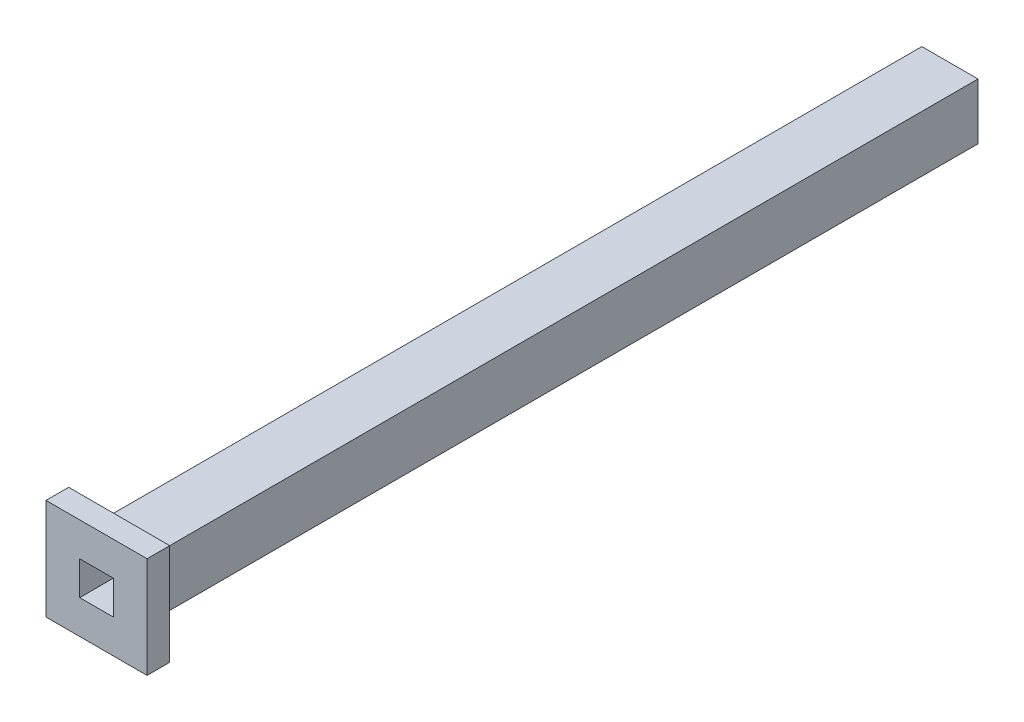
from build123d import *

# Parameters (mm, degrees)
SKETCH1_W            = 10
SKETCH1_H            = 10
SKETCH1_W_2          = 6
SKETCH1_H_2          = 6
BOSS_EXTRUDE1_DEPTH  = 2.54
BOSS_EXTRUDE4_DEPTH  = 2.54
CUT_EXTRUDE4_DEPTH   = 2.54
BOSS_EXTRUDE6_DEPTH  = 2.54
BOSS_EXTRUDE7_DEPTH  = 2.54
SKETCH8_W            = 16
SKETCH8_H            = 16
SKETCH8_W_2          = 12
SKETCH8_H_2          = 12
CUT_EXTRUDE5_DEPTH   = 0.5
SKETCH9_W            = 8
SKETCH9_H            = 8
BOSS_EXTRUDE8_DEPTH  = 0.5
SKETCH10_W           = 12
SKETCH10_H           = 12
SKETCH10_W_2         = 8
SKETCH10_H_2         = 8
CUT_EXTRUDE6_DEPTH   = 10
SKETCH11_W           = 16
SKETCH11_H           = 16
SKETCH11_W_2         = 8
SKETCH11_H_2         = 8
BOSS_EXTRUDE9_DEPTH  = 2
SKETCH13_W           = 8
SKETCH13_H           = 8
CUT_EXTRUDE7_DEPTH   = 2
SKETCH14_W           = 10
SKETCH14_H           = 10
SKETCH14_W_2         = 6
SKETCH14_H_2         = 6
CUT_EXTRUDE8_DEPTH   = 2
SKETCH16_W           = 14
SKETCH16_H           = 14
SKETCH16_W_2         = 12
SKETCH16_H_2         = 12
CUT_EXTRUDE12_DEPTH  = 10
SKETCH17_W           = 18
SKETCH17_H           = 18
SKETCH17_W_2         = 16
SKETCH17_H_2         = 16
BOSS_EXTRUDE10_DEPTH = 4
SKETCH18_W           = 18
SKETCH18_H           = 18
SKETCH18_W_2         = 16
SKETCH18_H_2         = 16
BOSS_EXTRUDE11_DEPTH = 1
SKETCH19_W           = 10
SKETCH19_H           = 10
SKETCH19_W_2         = 6
SKETCH19_H_2         = 6
BOSS_EXTRUDE12_DEPTH = 150
SKETCH20_W           = 10
SKETCH20_H           = 10
BOSS_EXTRUDE13_DEPTH = 2


with BuildPart() as part:
    # Sketch1 → Boss-Extrude1 (new body)
    with BuildSketch(Plane.XY):
        with Locations((3, 3)):
            Rectangle(SKETCH1_W, SKETCH1_H)
        with Locations((3, 3)):
            Rectangle(SKETCH1_W_2, SKETCH1_H_2, mode=Mode.SUBTRACT)
    extrude(amount=BOSS_EXTRUDE1_DEPTH)

    # Sketch2 → Boss-Extrude4 (add)
    with BuildSketch(Plane(origin=(0, 0, 0), x_dir=(-1, 0, 0), z_dir=(0, 0, -1))):
        Polygon((-8, 8), (-8, -2), (2, -2), (2, -4), (-10, -4), (-10, 8), align=None)
    extrude(amount=-BOSS_EXTRUDE4_DEPTH)

    # Sketch5 → Cut-Extrude4 (cut)
    with BuildSketch(Plane(origin=(0, 0, 0), x_dir=(-1, 0, 0), z_dir=(0, 0, -1))):
        Polygon((-6, 6), (-6, 0), (0, 0), (0, -2), (-8, -2), (-8, 6), align=None)
    extrude(amount=-CUT_EXTRUDE4_DEPTH, mode=Mode.SUBTRACT)

    # Sketch6 → Boss-Extrude6 (add)
    with BuildSketch(Plane(origin=(0, 0, 0), x_dir=(-1, 0, 0), z_dir=(0, 0, -1))):
        Polygon((-10, 8), (-10, -4), (2, -4), (2, -6), (-12, -6), (-12, 8), align=None)
    extrude(amount=-BOSS_EXTRUDE6_DEPTH)

    # Sketch7 → Boss-Extrude7 (add)
    with BuildSketch(Plane(origin=(0, 0, 0), x_dir=(-1, 0, 0), z_dir=(0, 0, -1))):
        Polygon((-12, 8), (2, 8), (2, -6), (4, -6), (4, 10), (-12, 10), align=None)
    extrude(amount=-BOSS_EXTRUDE7_DEPTH)

    # Sketch8 → Cut-Extrude5 (cut)
    with BuildSketch(Plane(origin=(0, 0, 0), x_dir=(-1, 0, 0), z_dir=(0, 0, -1))):
        with Locations((-4, 2)):
            Rectangle(SKETCH8_W, SKETCH8_H)
        with Locations((-4, 2)):
            Rectangle(SKETCH8_W_2, SKETCH8_H_2, mode=Mode.SUBTRACT)
    extrude(amount=-CUT_EXTRUDE5_DEPTH, mode=Mode.SUBTRACT)

    # Sketch10 → Cut-Extrude6 (cut)
    with BuildSketch(Plane(origin=(0, 0, 0), x_dir=(-1, 0, 0), z_dir=(0, 0, -1))):
        with Locations((-4, 2)):
            Rectangle(SKETCH10_W, SKETCH10_H)
        with Locations((-4, 2)):
            Rectangle(SKETCH10_W_2, SKETCH10_H_2, mode=Mode.SUBTRACT)
    extrude(amount=-CUT_EXTRUDE6_DEPTH, mode=Mode.SUBTRACT)

    # Sketch11 → Boss-Extrude9 (add)
    with BuildSketch(Plane.XY.offset(2.54)):
        with Locations((4, 2)):
            Rectangle(SKETCH11_W, SKETCH11_H)
        with Locations((4, 2)):
            Rectangle(SKETCH11_W_2, SKETCH11_H_2, mode=Mode.SUBTRACT)
    extrude(amount=BOSS_EXTRUDE9_DEPTH)

    # Sketch14 → Cut-Extrude8 (cut)
    with BuildSketch(Plane(origin=(0, 0, 2.54), x_dir=(-1, 0, 0), z_dir=(0, 0, -1))):
        with Locations((-4, 2)):
            Rectangle(SKETCH14_W, SKETCH14_H)
        with Locations((-4, 2)):
            Rectangle(SKETCH14_W_2, SKETCH14_H_2, mode=Mode.SUBTRACT)
    extrude(amount=-CUT_EXTRUDE8_DEPTH, mode=Mode.SUBTRACT)

    # Sketch16 → Cut-Extrude12 (cut)
    with BuildSketch(Plane(origin=(0, 0, 2.54), x_dir=(-1, 0, 0), z_dir=(0, 0, -1))):
        with Locations((-4, 2)):
            Rectangle(SKETCH16_W, SKETCH16_H)
        with Locations((-4, 2)):
            Rectangle(SKETCH16_W_2, SKETCH16_H_2, mode=Mode.SUBTRACT)
    extrude(amount=CUT_EXTRUDE12_DEPTH, mode=Mode.SUBTRACT)

    # Sketch17 → Boss-Extrude10 (add)
    with BuildSketch(Plane(origin=(0, 0, 0.5), x_dir=(-1, 0, 0), z_dir=(0, 0, -1))):
        with Locations((-4, 2)):
            Rectangle(SKETCH17_W, SKETCH17_H)
        with Locations((-4, 2)):
            Rectangle(SKETCH17_W_2, SKETCH17_H_2, mode=Mode.SUBTRACT)
    extrude(amount=-BOSS_EXTRUDE10_DEPTH)

    # Sketch18 → Boss-Extrude11 (add)
    with BuildSketch(Plane.XY.offset(4.54)):
        with Locations((4, 2)):
            Rectangle(SKETCH18_W, SKETCH18_H)
        with Locations((4, 2)):
            Rectangle(SKETCH18_W_2, SKETCH18_H_2, mode=Mode.SUBTRACT)
    extrude(amount=-BOSS_EXTRUDE11_DEPTH)

    # Sketch19 → Boss-Extrude12 (add)
    with BuildSketch(Plane.XY.offset(4.54)):
        with Locations((4, 2)):
            Rectangle(SKETCH19_W, SKETCH19_H)
        with Locations((4, 2)):
            Rectangle(SKETCH19_W_2, SKETCH19_H_2, mode=Mode.SUBTRACT)
    extrude(amount=-BOSS_EXTRUDE12_DEPTH)

    # Sketch20 → Boss-Extrude13 (add)
    with BuildSketch(Plane(origin=(0, 0, -145.46), x_dir=(-1, 0, 0), z_dir=(0, 0, -1))):
        with Locations((-4, 2)):
            Rectangle(SKETCH20_W, SKETCH20_H)
    extrude(amount=BOSS_EXTRUDE13_DEPTH)


with BuildPart() as body_2:
    # Sketch9 → Boss-Extrude8 (new body)
    with BuildSketch(Plane(origin=(0, 0, 0), x_dir=(-1, 0, 0), z_dir=(0, 0, -1))):
        with Locations((-4, 2)):
            Rectangle(SKETCH9_W, SKETCH9_H)
    extrude(amount=BOSS_EXTRUDE8_DEPTH)

    # Sketch13 → Cut-Extrude7 (cut)
    with BuildSketch(Plane(origin=(0, 0, -0.5), x_dir=(-1, 0, 0), z_dir=(0, 0, -1))):
        with Locations((-4, 2)):
            Rectangle(SKETCH13_W, SKETCH13_H)
    extrude(amount=-CUT_EXTRUDE7_DEPTH, mode=Mode.SUBTRACT)


solid = part.part
